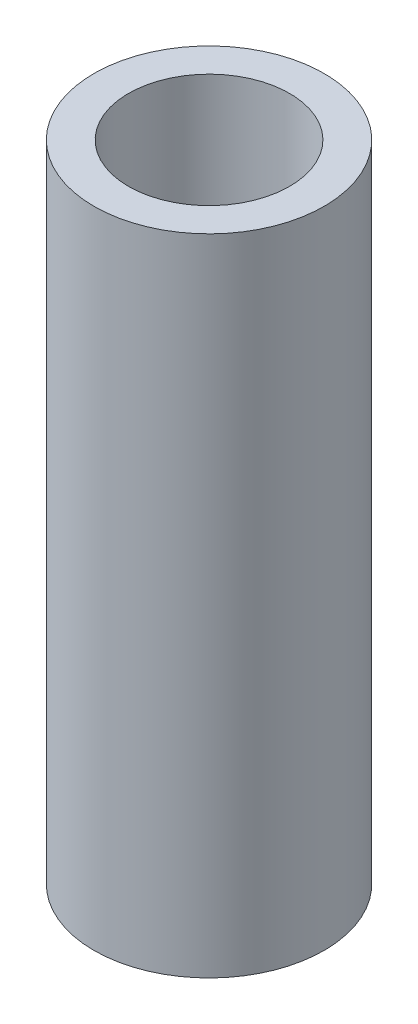
from build123d import *

# Parameters (mm, degrees)
SKETCH1_R           = 2.5
SKETCH1_R_2         = 1.75
BOSS_EXTRUDE1_DEPTH = 14


with BuildPart() as part:
    # Sketch1 → Boss-Extrude1 (new body)
    with BuildSketch(Plane(origin=(0, 0, 0), x_dir=(1, 0, 0), z_dir=(0, 1, 0))):
        with Locations(Location((0, 0, 0), (0, 0, 270))):
            Circle(SKETCH1_R)
        with Locations(Location((0, 0, 0), (0, 0, 270))):
            Circle(SKETCH1_R_2, mode=Mode.SUBTRACT)
    extrude(amount=BOSS_EXTRUDE1_DEPTH)


solid = part.part
